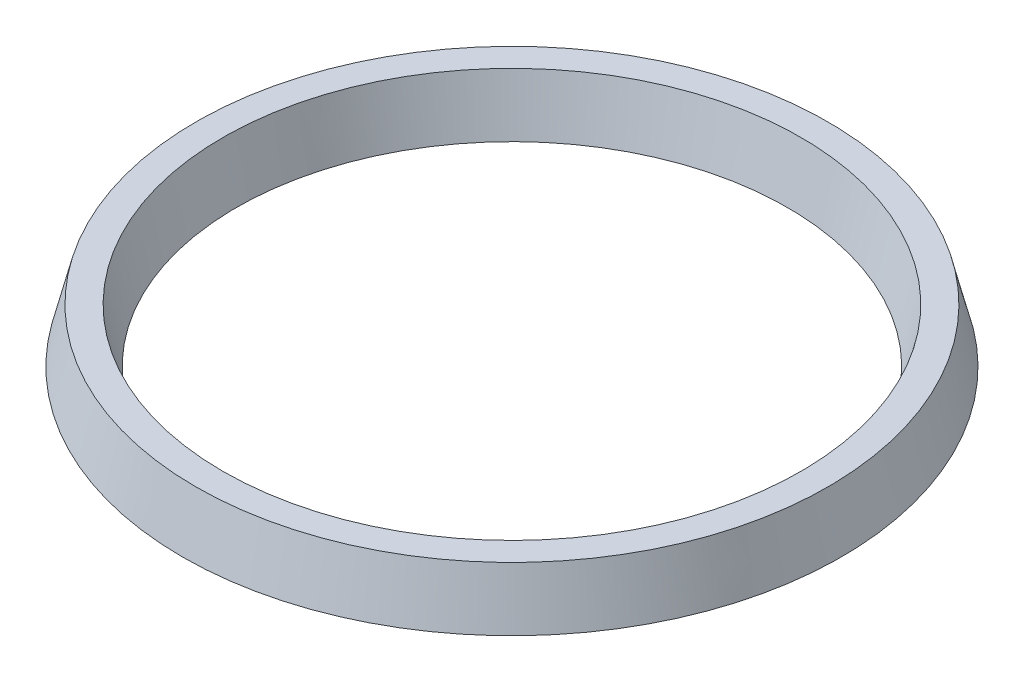
from build123d import *


with BuildPart() as part:
    # Sketch1 → Revolve1 (revolve)
    with BuildSketch(Plane(origin=(0, 0, 0), x_dir=(0, 0, -1), z_dir=(1, 0, 0)), mode=Mode.PRIVATE) as revolve1_sk:
        with BuildLine():
            Line((64.31, 6), (70.31, 6))
            Line((70.31, 6), (73.31, -6))
            Line((73.31, -6), (70.31, -6))
            Line((70.31, -6), (69.173803438, -1.45521375))
            ThreePointArc((69.173803438, -1.45521375), (67.31, 0), (65.446196562, -1.45521375))
            Line((65.446196562, -1.45521375), (64.31, -6))
            Line((64.31, -6), (61.31, -6))
            Line((61.31, -6), (64.31, 6))
        make_face()
    revolve(revolve1_sk.sketch.rotate(Axis((0, 0, 0), (0, -1, 0)), 180), axis=Axis((0, 0, 0), (0, -1, 0)))


solid = part.part
